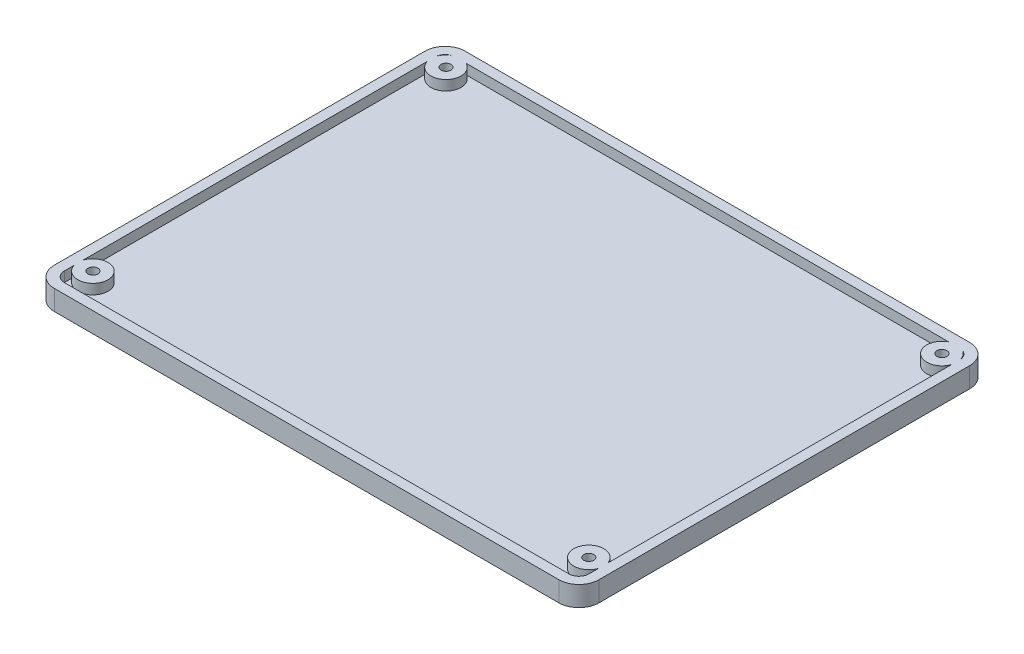
from build123d import *

# Parameters (mm, degrees)
SKETCH1_W           = 162.8
SKETCH1_H           = 122.8
SKETCH1_R           = 1.5
BOSS_EXTRUDE1_DEPTH = 6
FILLET1_R           = 6
SHELL5_T            = -3


with BuildPart() as part:
    # Sketch1 → Boss-Extrude1 (new body)
    with BuildSketch(Plane(origin=(0, 0, 0), x_dir=(1, 0, 0), z_dir=(0, 1, 0))):
        Rectangle(SKETCH1_W, SKETCH1_H)
        with Locations(Location((-74.100221616, 54.366983464, 0), (0, 0, 270))):
            Circle(SKETCH1_R, mode=Mode.SUBTRACT)
        with Locations(Location((74.107411227, 54.366983464, 0), (0, 0, 270))):
            Circle(SKETCH1_R, mode=Mode.SUBTRACT)
        with Locations(Location((74.107411227, -51.150377924, 0), (0, 0, 270))):
            Circle(SKETCH1_R, mode=Mode.SUBTRACT)
        with Locations(Location((-74.100221616, -51.150377924, 0), (0, 0, 270))):
            Circle(SKETCH1_R, mode=Mode.SUBTRACT)
    extrude(amount=BOSS_EXTRUDE1_DEPTH)

    # Fillet1
    fillet1_edges = [part.edges().sort_by_distance(p)[0] for p in [
        (81.4, 3, 61.4),
        (-81.4, 3, 61.4),
        (-81.4, 3, -61.4),
        (81.4, 3, -61.4),
    ]]
    fillet(fillet1_edges, radius=FILLET1_R)

    # Shell5
    shell5_openings = [part.faces().sort_by_distance(p)[0] for p in [
        (-5.099e-06, 6, 0.002281365),
    ]]
    offset(amount=SHELL5_T, openings=shell5_openings)


solid = part.part
